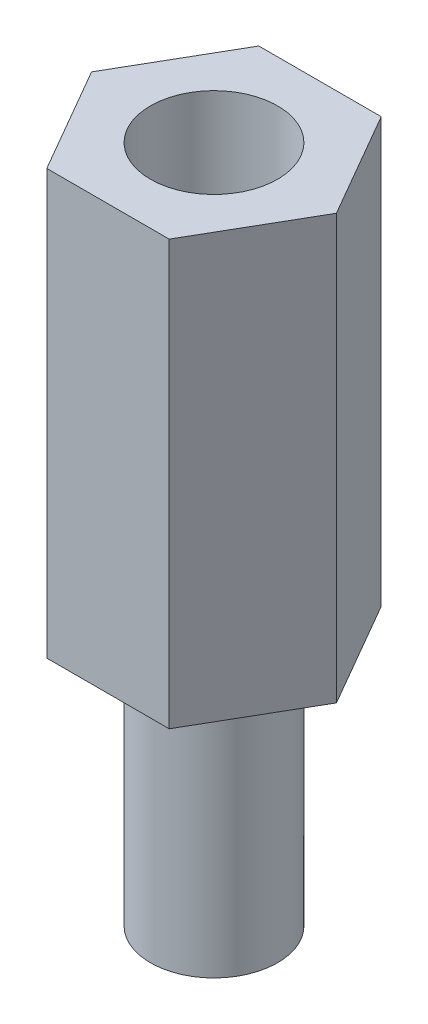
from build123d import *

# Parameters (mm, degrees)
CROQUIS1_R              = 1.5
SALIENTE_EXTRUIR1_DEPTH = 10
CROQUIS2_R              = 1.5
SALIENTE_EXTRUIR2_DEPTH = 6


with BuildPart() as part:
    # Croquis1 → Saliente-Extruir1 (new body)
    with BuildSketch(Plane(origin=(0, 0, 0), x_dir=(1, 0, 0), z_dir=(0, 1, 0))):
        Polygon((1.443375673, -2.5), (2.886751346, 0), (1.443375673, 2.5), (-1.443375673, 2.5), (-2.886751346, 0), (-1.443375673, -2.5), align=None)
        with Locations(Location((0, 0, 0), (0, 0, 270))):
            Circle(CROQUIS1_R, mode=Mode.SUBTRACT)
    extrude(amount=SALIENTE_EXTRUIR1_DEPTH)


with BuildPart() as body_2:
    # Croquis2 → Saliente-Extruir2 (new body)
    with BuildSketch(Plane.XZ):
        with Locations(Location((0, 0, 0), (0, 0, 270))):
            Circle(CROQUIS2_R)
    extrude(amount=SALIENTE_EXTRUIR2_DEPTH)


solid = Compound([part.part, body_2.part])
